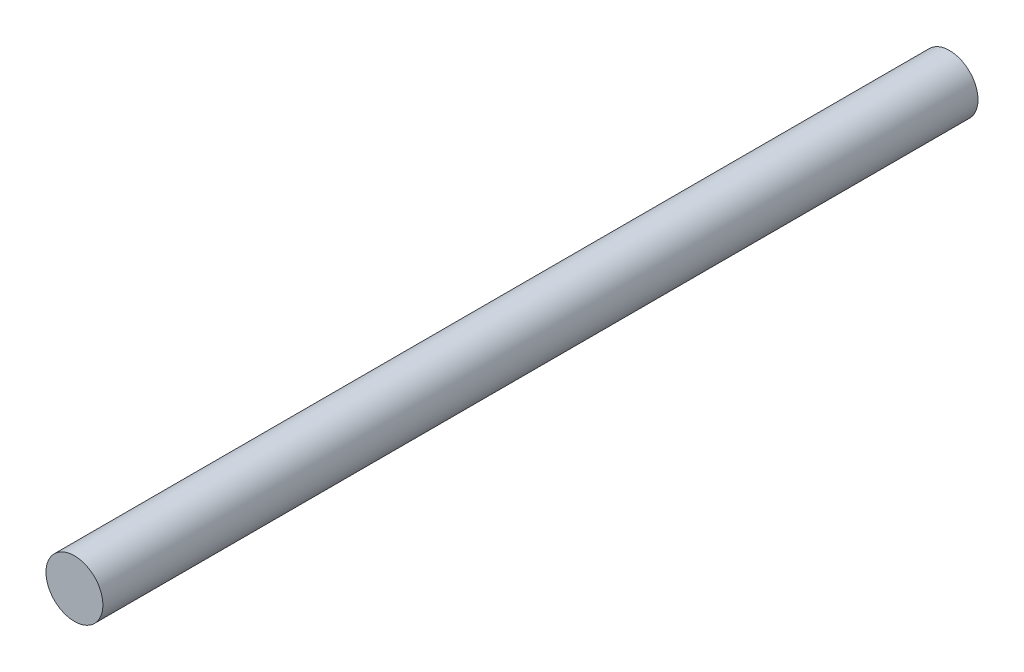
from build123d import *

# Parameters (mm, degrees)
CROQUIS1_R              = 7.5
SALIENTE_EXTRUIR1_DEPTH = 230.51


with BuildPart() as part:
    # Croquis1 → Saliente-Extruir1 (new body)
    with BuildSketch(Plane.XY):
        Circle(CROQUIS1_R)
    extrude(amount=SALIENTE_EXTRUIR1_DEPTH)


solid = part.part
